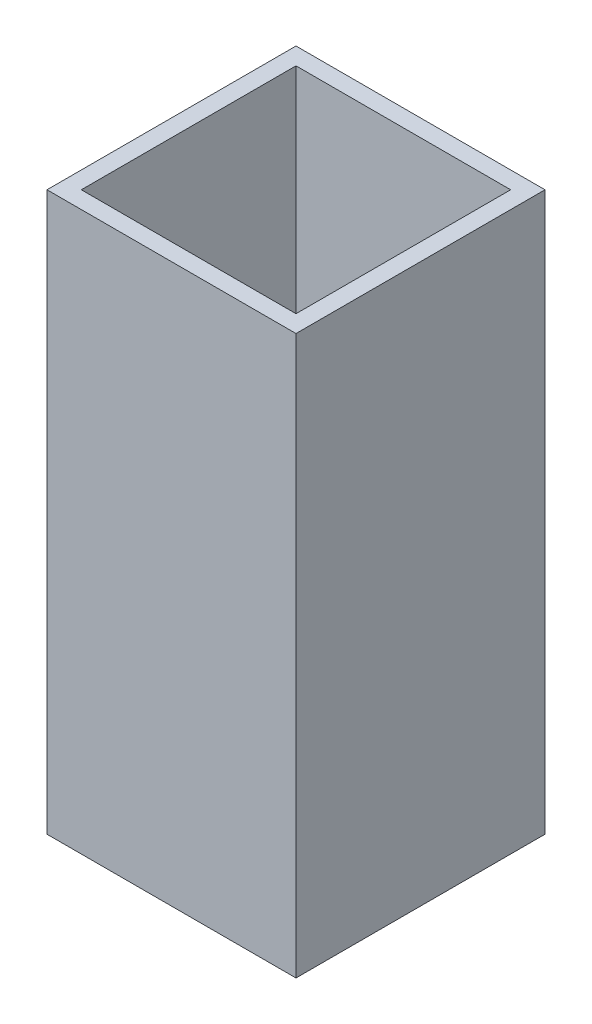
from build123d import *

# Parameters (mm, degrees)
SKETCH_1_W      = 29
SKETCH_1_H      = 29
EXTRUDE_1_DEPTH = 65
SHELL_1_T       = -2


with BuildPart() as part:
    # Эскиз1 → Бобышка-Вытянуть1 (new body)
    with BuildSketch(Plane(origin=(0, 0, 0), x_dir=(1, 0, 0), z_dir=(0, 1, 0))):
        Rectangle(SKETCH_1_W, SKETCH_1_H)
    extrude(amount=EXTRUDE_1_DEPTH)

    # Оболочка1
    shell_1_openings = [part.faces().sort_by_distance(p)[0] for p in [
        (0, 65, 0),
        (0, 0, 0),
    ]]
    offset(amount=SHELL_1_T, openings=shell_1_openings, kind=Kind.INTERSECTION)


solid = part.part
